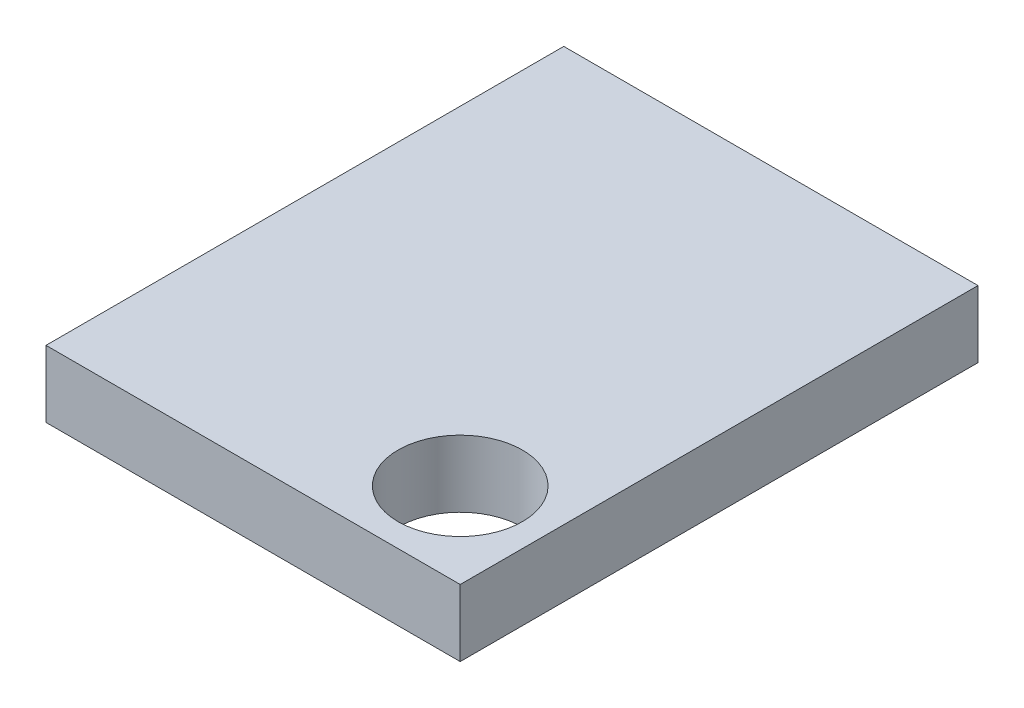
from build123d import *

# Parameters (mm, degrees)
SKETCH1_W           = 10.16
SKETCH1_H           = 12.7
BOSS_EXTRUDE1_DEPTH = 1.6383
SKETCH2_R           = 1.524
CUT_EXTRUDE1_DEPTH  = 1.6383


with BuildPart() as part:
    # Sketch1 → Boss-Extrude1 (new body)
    with BuildSketch(Plane(origin=(0, 0, 0), x_dir=(1, 0, 0), z_dir=(0, 1, 0))):
        Rectangle(SKETCH1_W, SKETCH1_H)
    extrude(amount=BOSS_EXTRUDE1_DEPTH)

    # Sketch2 → Cut-Extrude1 (cut)
    with BuildSketch(Plane(origin=(0, 1.6383, 0), x_dir=(1, 0, 0), z_dir=(0, 1, 0))):
        with Locations(Location((2.9845, -4.2545, 0), (0, 0, 270))):
            Circle(SKETCH2_R)
    extrude(amount=-CUT_EXTRUDE1_DEPTH, mode=Mode.SUBTRACT)


solid = part.part
